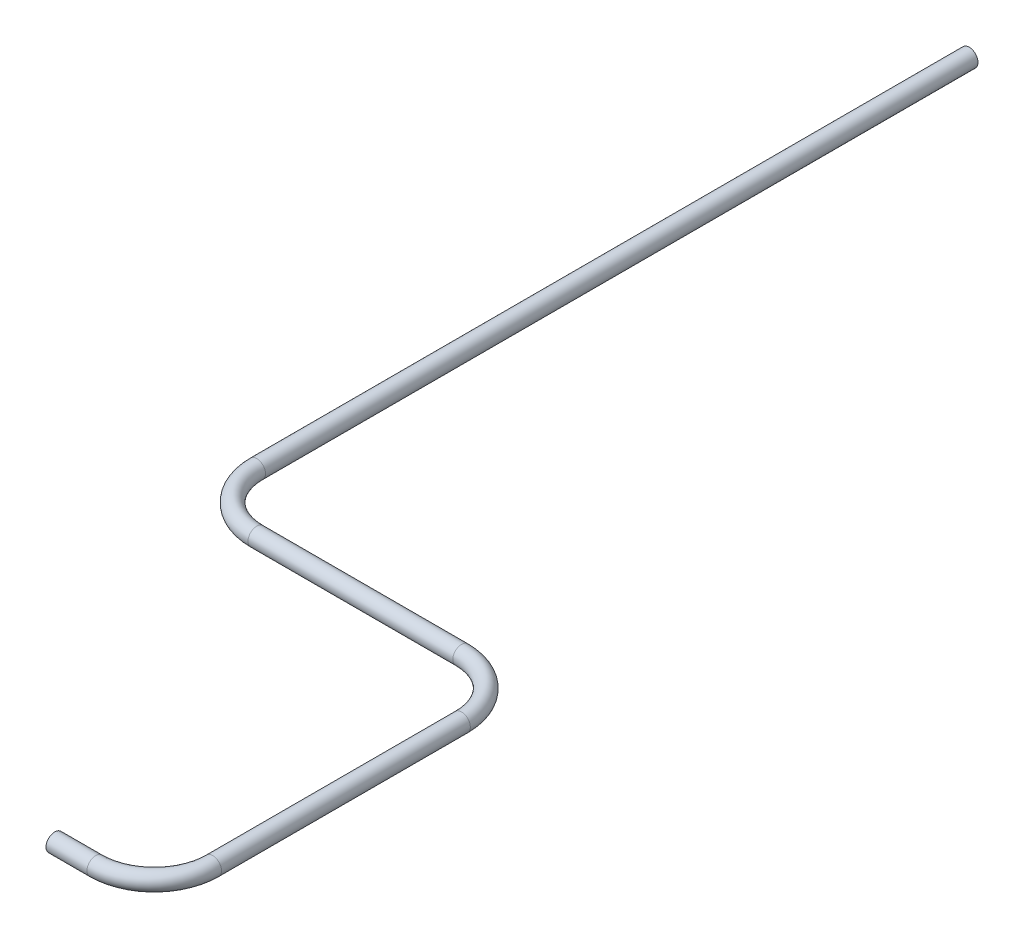
from build123d import *

# Parameters (mm, degrees)
BARRER2_PROFILE_R = 1.5


with BuildPart() as part:
    # Barrer2: sweep along a path in Croquis1
    with BuildLine(Plane(origin=(0, 0, 0), x_dir=(1, 0, 0), z_dir=(0, 1, 0))) as barrer2_path:
        Line((0, 0), (0, -121.77))
        ThreePointArc((0, -121.77), (2.928932188, -128.841067812), (10, -131.77))
        Line((10, -131.77), (45, -131.77))
        ThreePointArc((45, -131.77), (52.071067812, -134.698932188), (55, -141.77))
        Line((55, -141.77), (55, -184.29))
        ThreePointArc((55, -184.29), (52.071067812, -191.361067812), (45, -194.29))
        Line((45, -194.29), (38, -194.29))
    # Barrer2 profile (on start of the path) → Barrer2 (sweep)
    with BuildSketch(Plane.XY):
        Circle(BARRER2_PROFILE_R)
    sweep(path=barrer2_path.line)


solid = part.part
